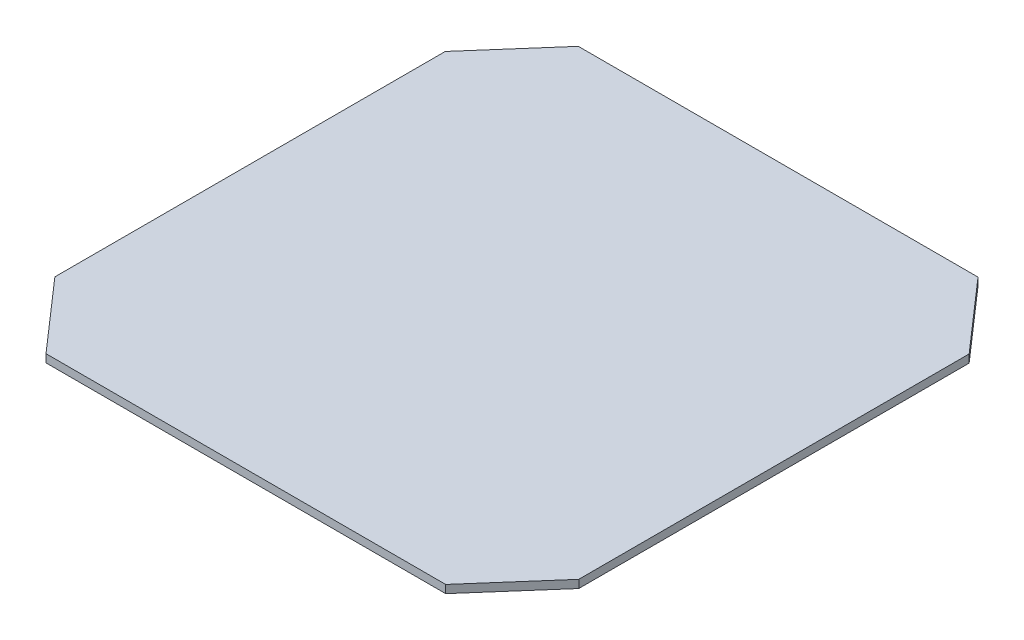
from build123d import *

# Parameters (mm, degrees)
BOSS_EXTRU_1_DEPTH = 5


with BuildPart() as part:
    # Esquisse1 → Boss.-Extru.1 (new body)
    with BuildSketch(Plane(origin=(0, 0, 0), x_dir=(1, 0, 0), z_dir=(0, 1, 0))):
        Polygon((-125, 166.483516484), (125, 166.483516484), (163.846153846, 122.087912088), (163.846153846, -122.087912088), (125, -166.483516484), (-125, -166.483516484), (-163.846153846, -122.087912088), (-163.846153846, 122.087912088), align=None)
    extrude(amount=BOSS_EXTRU_1_DEPTH)


solid = part.part
